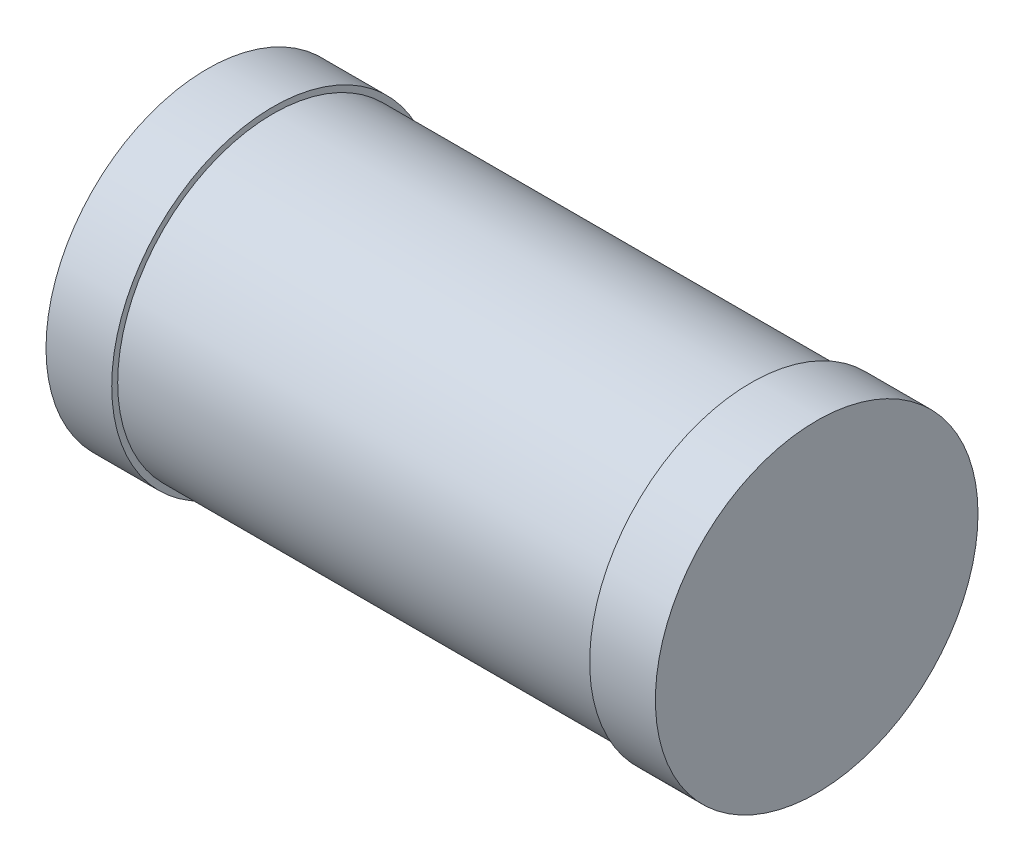
from build123d import *

# Parameters (mm, degrees)
EXTRUDE_1_DEPTH      = 2.5
EXTRUDE_1_DEPTH_BACK = 2.5
SKETCH_1_R           = 1.3
EXTRUDE_3_DEPTH      = 0.05
EXTRUDE_3_DEPTH_BACK = 0.5
SKETCH_6_R           = 1.35
EXTRUDE_4_DEPTH      = 0.05
EXTRUDE_4_DEPTH_BACK = 0.5
SKETCH_8_R           = 1.35


with BuildPart() as part:
    # Эскиз1 → Бобышка-Вытянуть1 (new, two sides: drawn at the far end of the back side and taken through both)
    with BuildSketch(Plane(origin=(0, 0, 0), x_dir=(0, 0, -1), z_dir=(1, 0, 0)).offset(-EXTRUDE_1_DEPTH_BACK)):
        Circle(SKETCH_1_R)
    extrude(amount=EXTRUDE_1_DEPTH + EXTRUDE_1_DEPTH_BACK)

    # Эскиз6 → Бобышка-Вытянуть3 (add, two sides: drawn at the far end of the back side and taken through both)
    with BuildSketch(Plane(origin=(2.5, 0, 0), x_dir=(0, 0, -1), z_dir=(1, 0, 0)).offset(-EXTRUDE_3_DEPTH_BACK)):
        Circle(SKETCH_6_R)
    extrude(amount=EXTRUDE_3_DEPTH + EXTRUDE_3_DEPTH_BACK)

    # Эскиз8 → Бобышка-Вытянуть4 (add, two sides: drawn at the far end of the back side and taken through both)
    with BuildSketch(Plane.ZY.offset(2.5).offset(-EXTRUDE_4_DEPTH_BACK)):
        Circle(SKETCH_8_R)
    extrude(amount=EXTRUDE_4_DEPTH + EXTRUDE_4_DEPTH_BACK)


solid = part.part
